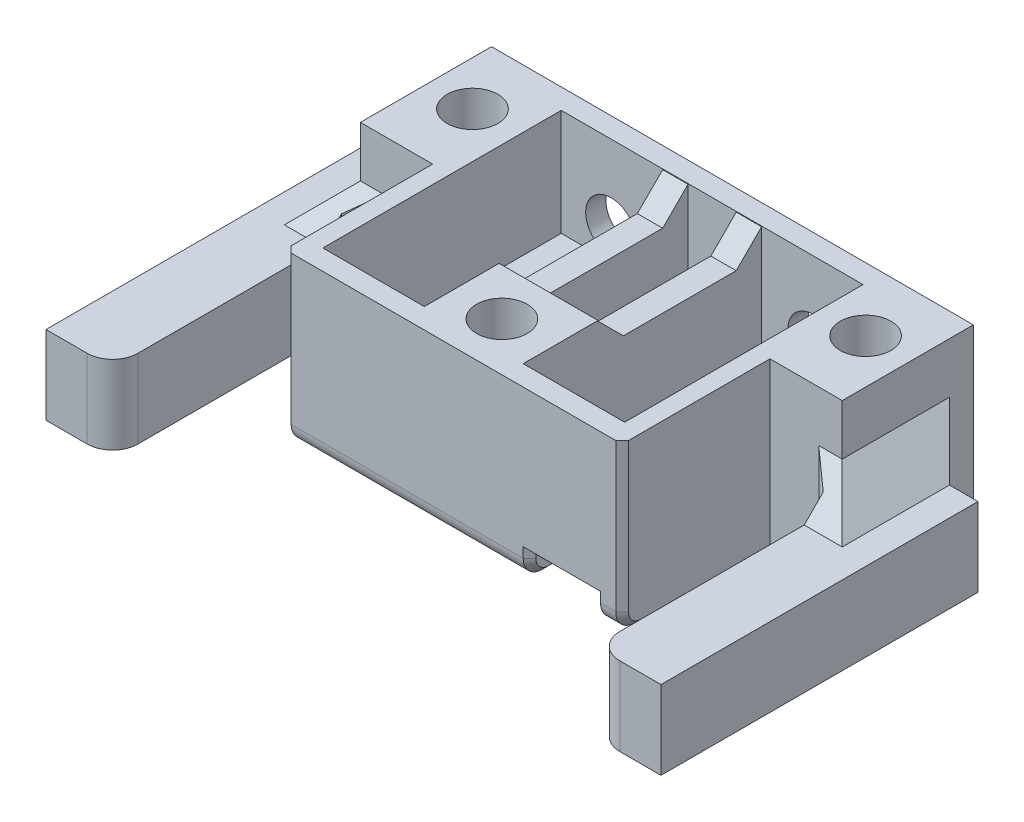
from build123d import *

# Parameters (mm, degrees)
SKETCH1_W                 = 27
SKETCH1_H                 = 22
BOSS_EXTRUDE1_DEPTH       = 12
SHELL1_T                  = -1.6
SKETCH2_W                 = 2
SKETCH2_H                 = 18.8
BOSS_EXTRUDE2_DEPTH       = 10.4
SKETCH4_R                 = 2
CUT_EXTRUDE2_DEPTH        = 9
SKETCH6_W                 = 10.34
SKETCH6_H                 = 12
BOSS_EXTRUDE4_DEPTH       = 5.5
SKETCH7_W                 = 25
SKETCH7_H                 = 5
BOSS_EXTRUDE5_DEPTH       = 5.25
CHAMFER1_SIZE             = 3
SKETCH8_R                 = 2
CUT_EXTRUDE3_DEPTH        = 33.994744773
CHAMFER2_SIZE             = 1.5
CHAMFER2_SIZE2            = 1.852345735
FILLET1_R                 = 2
CHAMFER1_OF_MIRROR1_SIZE  = 3
CHAMFER2_OF_MIRROR1_SIZE2 = 1.5
CHAMFER2_OF_MIRROR1_SIZE  = 1.852345735
FILLET1_OF_MIRROR1_R      = 2
BOSS_EXTRUDE7_START       = 1.2
BOSS_EXTRUDE7_DEPTH       = 1.2
SKETCH13_W                = 4.5
SKETCH13_H                = 22
CUT_EXTRUDE5_DEPTH        = 1
SKETCH17_W                = 11.66
SKETCH17_H                = 13.2
CUT_TOLERANCE_FIX_DEPTH   = 0.2
FILLET2_R                 = 1.5
SKETCH18_W                = 3.8
SKETCH18_H                = 5.9
BOSS_EXTRUDE8_DEPTH       = 10.4
SKETCH11_R                = 2
CUT_EXTRUDE6_DEPTH        = 10
SKETCH19_W                = 8
SKETCH19_H                = 18.8
BOSS_EXTRUDE9_DEPTH       = 2
SKETCH20_W                = 4.5
SKETCH20_H                = 22
CUT_EXTRUDE7_DEPTH        = 0.1
SKETCH21_W                = 7.8
SKETCH21_H                = 12.9
CUT_EXTRUDE8_DEPTH        = 2.05
CHAMFER4_SIZE             = 2
CHAMFER5_SIZE             = 3
TOLERANCE_ADJ_DEPTH       = 0.6
CHAMFER6_SIZE             = 0.5


with BuildPart() as part:
    # Sketch1 → Boss-Extrude1 (new body)
    with BuildSketch(Plane(origin=(0, 0, 0), x_dir=(1, 0, 0), z_dir=(0, 1, 0))):
        Rectangle(SKETCH1_W, SKETCH1_H)
    extrude(amount=BOSS_EXTRUDE1_DEPTH)

    # Shell1
    shell1_openings = [part.faces().sort_by_distance(p)[0] for p in [
        (0, 12, 0),
    ]]
    offset(amount=SHELL1_T, openings=shell1_openings, kind=Kind.INTERSECTION)

    # Sketch2 → Boss-Extrude2 (add)
    with BuildSketch(Plane(origin=(0, 1.6, 0), x_dir=(1, 0, 0), z_dir=(0, 1, 0))):
        with Locations((-2.9, 0)):
            Rectangle(SKETCH2_W, SKETCH2_H)
    boss_extrude2 = extrude(amount=BOSS_EXTRUDE2_DEPTH)

    # Sketch4 → Cut-Extrude2 (cut)
    with BuildSketch(Plane(origin=(0, 0, -11), x_dir=(-1, 0, 0), z_dir=(0, 0, -1))):
        with Locations((7.973688368, 6)):
            Circle(SKETCH4_R)
    cut_extrude2 = extrude(amount=-CUT_EXTRUDE2_DEPTH, mode=Mode.SUBTRACT)

    # Sketch6 → Boss-Extrude4 (add)
    with BuildSketch(Plane.ZY.offset(13.5)):
        with Locations((-5.83, 6)):
            Rectangle(SKETCH6_W, SKETCH6_H)
    boss_extrude4 = extrude(amount=BOSS_EXTRUDE4_DEPTH)

    # Sketch7 → Boss-Extrude5 (add)
    with BuildSketch(Plane.ZY.offset(19)):
        with Locations((6.383608836, 2.5)):
            Rectangle(SKETCH7_W, SKETCH7_H)
    boss_extrude5 = extrude(amount=BOSS_EXTRUDE5_DEPTH)

    # Chamfer1
    chamfer1_edges = [part.edges().sort_by_distance(p)[0] for p in [
        (-19, 2.5, -6.116391164),
    ]]
    chamfer(chamfer1_edges, length=CHAMFER1_SIZE)

    # Sketch8 → Cut-Extrude3 (cut, through all)
    with BuildSketch(Plane(origin=(0, 12, 0), x_dir=(1, 0, 0), z_dir=(0, 1, 0))):
        with Locations(Location((-15.5, 6, 0), (0, 0, 270))):
            Circle(SKETCH8_R)
    cut_extrude3 = extrude(amount=-CUT_EXTRUDE3_DEPTH, mode=Mode.SUBTRACT)

    # Chamfer2
    chamfer2_edges = [part.edges().sort_by_distance(p)[0] for p in [
        (-19, 2.5, -0.66),
    ]]
    chamfer2_side = [part.faces().sort_by_distance(p)[0] for p in [
        (-19, 2.5, 9.111804418),
    ]]
    chamfer(chamfer2_edges, length=CHAMFER2_SIZE, length2=CHAMFER2_SIZE2, reference=chamfer2_side[0])

    # Fillet1
    fillet1_edges = [part.edges().sort_by_distance(p)[0] for p in [
        (-19, 2.5, 18.883608836),
    ]]
    fillet(fillet1_edges, radius=FILLET1_R)

    # Mirror1: Boss-Extrude2, Cut-Extrude2, Boss-Extrude4, Boss-Extrude5, Cut-Extrude3 across plane
    add(boss_extrude2.mirror(Plane.ZY))
    add(cut_extrude2.mirror(Plane.ZY), mode=Mode.SUBTRACT)
    add(boss_extrude4.mirror(Plane.ZY))
    add(boss_extrude5.mirror(Plane.ZY))
    add(cut_extrude3.mirror(Plane.ZY), mode=Mode.SUBTRACT)

    # Chamfer1 of Mirror1
    chamfer1_of_mirror1_edges = [part.edges().sort_by_distance(p)[0] for p in [
        (19, 2.5, -6.116391164),
    ]]
    chamfer(chamfer1_of_mirror1_edges, length=CHAMFER1_OF_MIRROR1_SIZE)

    # Chamfer2 of Mirror1
    chamfer2_of_mirror1_edges = [part.edges().sort_by_distance(p)[0] for p in [
        (19, 2.5, -0.66),
    ]]
    chamfer(chamfer2_of_mirror1_edges, length=CHAMFER2_OF_MIRROR1_SIZE, length2=CHAMFER2_OF_MIRROR1_SIZE2)

    # Fillet1 of Mirror1
    fillet1_of_mirror1_edges = [part.edges().sort_by_distance(p)[0] for p in [
        (19, 2.5, 18.883608836),
    ]]
    fillet(fillet1_of_mirror1_edges, radius=FILLET1_OF_MIRROR1_R)

    # Sketch12 → Boss-Extrude7 (add)
    with BuildSketch(Plane.XZ.offset(BOSS_EXTRUDE7_START)):
        with BuildLine():
            Line((6.6, 11), (-13.5, 11))
            Line((-13.5, 11), (-13.5, -0.66))
            Line((-13.5, -0.66), (-17.147654265, -0.66))
            Line((-17.147654265, -0.66), (-19, 0.84))
            Line((-19, 0.84), (-19, 16.883608836))
            ThreePointArc((-19, 16.883608836), (-19.585786438, 18.297822398), (-21, 18.883608836))
            Line((-21, 18.883608836), (-24.25, 18.883608836))
            Line((-24.25, 18.883608836), (-24.25, -6.116391164))
            Line((-24.25, -6.116391164), (-22, -6.116391164))
            Line((-22, -6.116391164), (-19, -9.116391164))
            Line((-19, -9.116391164), (-19, -11))
            Line((-19, -11), (6.6, -11))
            Line((6.6, -11), (6.6, 11))
        make_face()
        with BuildLine():
            Line((11.1, -11), (11.1, 11))
            Line((11.1, 11), (13.5, 11))
            Line((13.5, 11), (13.5, -0.66))
            Line((13.5, -0.66), (17.147654265, -0.66))
            Line((17.147654265, -0.66), (19, 0.84))
            Line((19, 0.84), (19, 16.883608836))
            ThreePointArc((19, 16.883608836), (19.585786438, 18.297822398), (21, 18.883608836))
            Line((21, 18.883608836), (24.25, 18.883608836))
            Line((24.25, 18.883608836), (24.25, -6.116391164))
            Line((24.25, -6.116391164), (22, -6.116391164))
            Line((22, -6.116391164), (19, -9.116391164))
            Line((19, -9.116391164), (19, -11))
            Line((19, -11), (11.1, -11))
        make_face()
    extrude(amount=-BOSS_EXTRUDE7_DEPTH)

    # Sketch13 → Cut-Extrude5 (cut)
    with BuildSketch(Plane(origin=(0, 0, 0), x_dir=(-1, 0, 0), z_dir=(0, -1, 0))):
        with Locations((-8.85, 0)):
            Rectangle(SKETCH13_W, SKETCH13_H)
    extrude(amount=-CUT_EXTRUDE5_DEPTH, mode=Mode.SUBTRACT)

    # Sketch17 → Cut- tolerance fix (cut)
    with BuildSketch(Plane.ZY.offset(13.5)):
        with Locations((5.17, 5.4)):
            Rectangle(SKETCH17_W, SKETCH17_H)
    cut_tolerance_fix = extrude(amount=-CUT_TOLERANCE_FIX_DEPTH, mode=Mode.SUBTRACT)

    # Mirror2: Cut- tolerance fix across plane
    add(cut_tolerance_fix.mirror(Plane.ZY), mode=Mode.SUBTRACT)

    # Fillet2
    fillet2_edges = [part.edges().sort_by_distance(p)[0] for p in [
        (-3.35, -1.2, 11),
        (12.2, -1.2, 11),
    ]]
    fillet(fillet2_edges, radius=FILLET2_R)

    # Sketch18 → Boss-Extrude8 (add)
    with BuildSketch(Plane(origin=(0, 1.6, 0), x_dir=(1, 0, 0), z_dir=(0, 1, 0))):
        with Locations((0, -6.45)):
            Rectangle(SKETCH18_W, SKETCH18_H)
    extrude(amount=BOSS_EXTRUDE8_DEPTH)

    # Sketch11 → Cut-Extrude6 (cut)
    with BuildSketch(Plane(origin=(0, 12, 0), x_dir=(1, 0, 0), z_dir=(0, 1, 0))):
        with Locations(Location((0, -7.181115317, 0), (0, 0, 270))):
            Circle(SKETCH11_R)
    extrude(amount=-CUT_EXTRUDE6_DEPTH, mode=Mode.SUBTRACT)

    # Sketch19 → Boss-Extrude9 (add)
    with BuildSketch(Plane(origin=(0, 1.6, 0), x_dir=(1, 0, 0), z_dir=(0, 1, 0))):
        with Locations((7.9, 0)):
            Rectangle(SKETCH19_W, SKETCH19_H)
        with Locations((-7.9, 0)):
            Rectangle(SKETCH19_W, SKETCH19_H)
    extrude(amount=BOSS_EXTRUDE9_DEPTH)

    # Sketch20 → Cut-Extrude7 (cut)
    with BuildSketch(Plane.XZ.offset(-1)):
        with Locations((8.85, 0)):
            Rectangle(SKETCH20_W, SKETCH20_H)
    extrude(amount=-CUT_EXTRUDE7_DEPTH, mode=Mode.SUBTRACT)

    # Sketch21 → Cut-Extrude8 (cut)
    with BuildSketch(Plane(origin=(0, 12, 0), x_dir=(1, 0, 0), z_dir=(0, 1, 0))):
        with Locations((0, 2.95)):
            Rectangle(SKETCH21_W, SKETCH21_H)
    extrude(amount=-CUT_EXTRUDE8_DEPTH, mode=Mode.SUBTRACT)

    # Chamfer4
    chamfer4_edges = [part.edges().sort_by_distance(p)[0] for p in [
        (-2.9, 9.95, -9.4),
        (-2.9, 9.95, 3.5),
        (2.9, 9.95, -9.4),
        (2.9, 9.95, 3.5),
    ]]
    chamfer(chamfer4_edges, length=CHAMFER4_SIZE)

    # Chamfer5
    chamfer5_edges = [part.edges().sort_by_distance(p)[0] for p in [
        (-18.073827133, 5, -0.66),
        (-19, 5, -4.888195582),
        (18.073827133, 5, -0.66),
        (19, 5, -4.888195582),
    ]]
    chamfer(chamfer5_edges, length=CHAMFER5_SIZE)

    # Sketch22 → tolerance adj (cut)
    with BuildSketch(Plane(origin=(6.6, 0, 0), x_dir=(0, 0, -1), z_dir=(1, 0, 0))):
        with BuildLine():
            Line((-11, 1.1), (-11, 0.3))
            ThreePointArc((-11, 0.3), (-10.560660172, -0.760660172), (-9.5, -1.2))
            Line((-9.5, -1.2), (11, -1.2))
            Line((11, -1.2), (11, 1.1))
            Line((11, 1.1), (-11, 1.1))
        make_face()
    extrude(amount=-TOLERANCE_ADJ_DEPTH, mode=Mode.SUBTRACT)

    # Chamfer6
    chamfer6_edges = [part.edges().sort_by_distance(p)[0] for p in [
        (-13.3, -1.2, 4.42),
        (13.3, -1.2, 4.42),
        (11.1, -1.2, -0.75),
        (11.1, 0.7, 11),
        (11.1, -0.760660172, 10.560660172),
        (13.3, 6.15, 11),
        (-13.3, 6.15, 11),
        (13.3, -0.760660172, 10.560660172),
        (-13.3, -0.760660172, 10.560660172),
        (6, -1.2, -0.75),
        (6, -0.760660172, 10.560660172),
        (6, 0.7, 11),
    ]]
    chamfer(chamfer6_edges, length=CHAMFER6_SIZE)


solid = part.part
